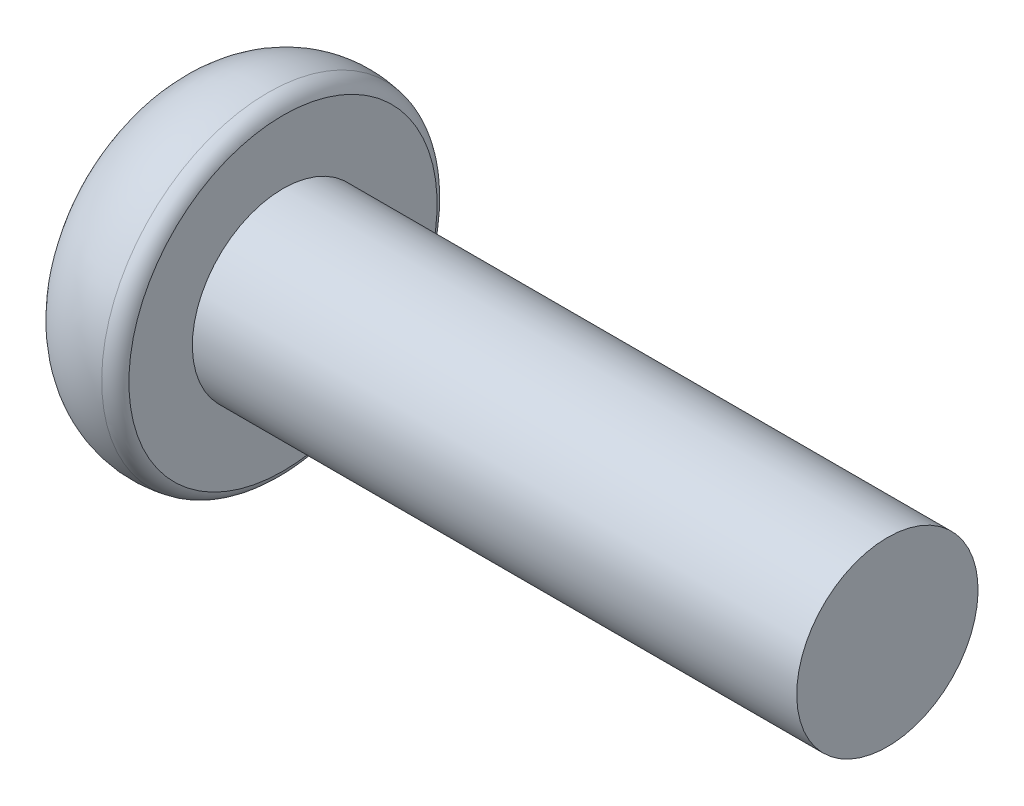
from build123d import *

# Parameters (mm, degrees)
CUT_EXTRUDE1_DEPTH = 3


with BuildPart() as part:
    # Sketch1 → Revolve1 (revolve)
    with BuildSketch(Plane.XY):
        with BuildLine():
            Line((0, 0), (20, 0))
            Line((20, 0), (20, -3))
            Line((20, -3), (-4, -3))
            Line((-4, -3), (-4, 0))
            ThreePointArc((-4, 0), (-2.788306012, 2.003628416), (-0.5, 2.5))
            ThreePointArc((-0.5, 2.5), (-0.192181086, 2.372273642), (0, 2.1))
            Line((0, 2.1), (0, 0))
        make_face()
    revolve(axis=Axis((20, -3, 0), (-1, 0, 0)))

    # Sketch2 → Cut-Extrude1 (cut)
    with BuildSketch(Plane.ZY.offset(4)):
        Polygon((0, -0.459658816), (-2.2, -1.729829408), (-2.2, -4.270170592), (0, -5.540341184), (2.2, -4.270170592), (2.2, -1.729829408), align=None)
    extrude(amount=-CUT_EXTRUDE1_DEPTH, mode=Mode.SUBTRACT)


solid = part.part
